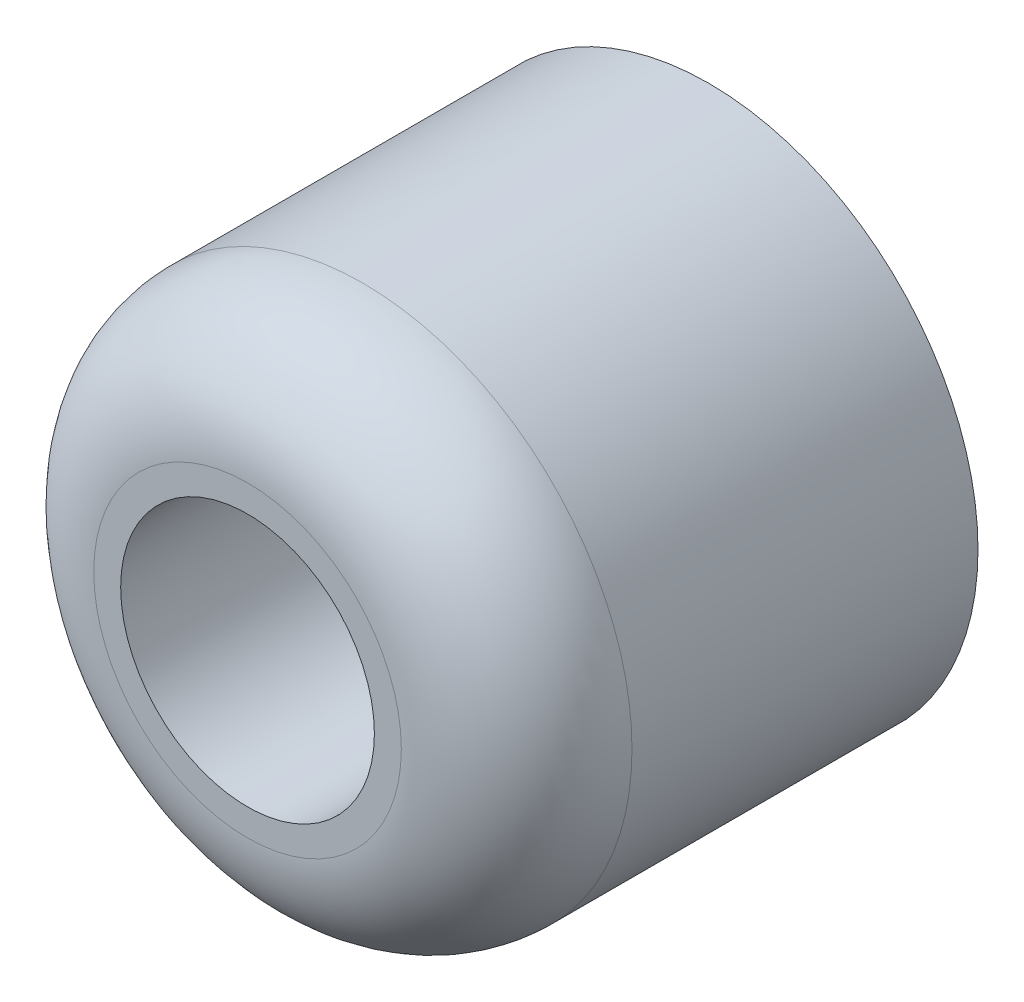
from build123d import *

# Parameters (mm, degrees)
SKETCH1_R           = 3.5
SKETCH1_R_2         = 1.65
BOSS_EXTRUDE1_DEPTH = 6
FILLET1_R           = 1.5


with BuildPart() as part:
    # Sketch1 → Boss-Extrude1 (new body)
    with BuildSketch(Plane.XY):
        Circle(SKETCH1_R)
        Circle(SKETCH1_R_2, mode=Mode.SUBTRACT)
    extrude(amount=BOSS_EXTRUDE1_DEPTH)

    # Fillet1
    fillet1_edges = [part.edges().sort_by_distance(p)[0] for p in [
        (-3.5, 0, 6),
    ]]
    fillet(fillet1_edges, radius=FILLET1_R)


solid = part.part
